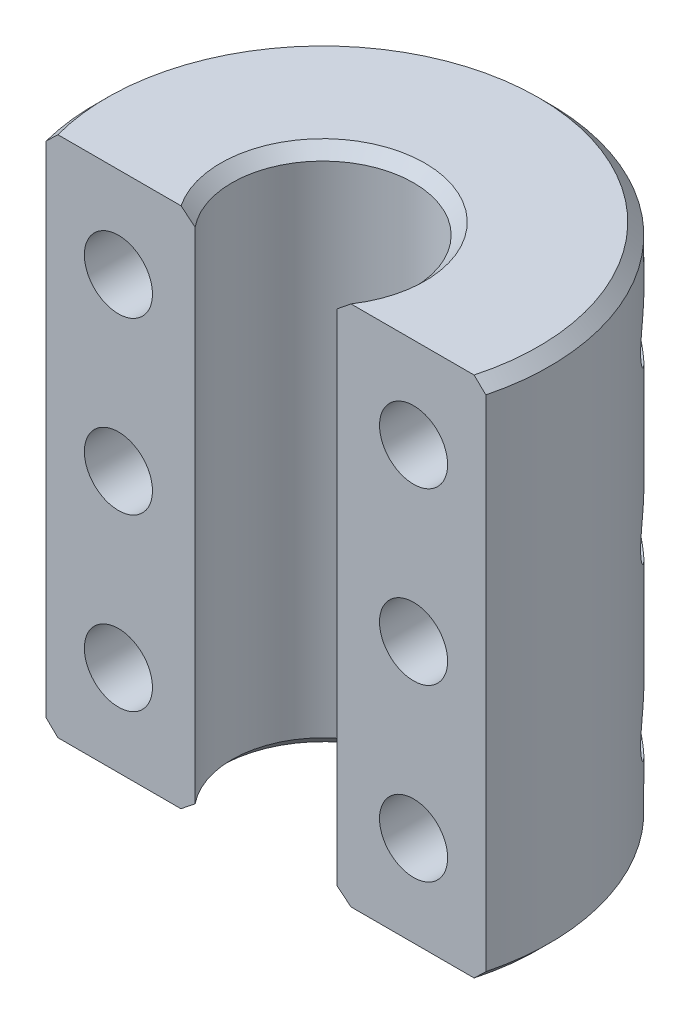
from build123d import *

# Parameters (mm, degrees)
SKETCH_1_R          = 10
SKETCH_1_R_2        = 4
EXTRUDE_1_DEPTH     = 23
CHAMFER_1_SIZE      = 0.5
SKETCH_2_W          = 20
SKETCH_2_H          = 23
CUT_EXTRUDE_1_DEPTH = 23
SKETCH_3_R          = 1.5
CUT_EXTRUDE_2_DEPTH = 29.022312538


with BuildPart() as part:
    # 草图1 → 凸台-拉伸1 (new body)
    with BuildSketch(Plane(origin=(0, 0, 0), x_dir=(1, 0, 0), z_dir=(0, 1, 0))):
        with Locations(Location((0, 0, 0), (0, 0, 270))):
            Circle(SKETCH_1_R)
        with Locations(Location((0, 0, 0), (0, 0, 270))):
            Circle(SKETCH_1_R_2, mode=Mode.SUBTRACT)
    extrude(amount=EXTRUDE_1_DEPTH)

    # 倒角1
    chamfer_1_edges = [part.edges().sort_by_distance(p)[0] for p in [
        (0, 0, -10),
        (0, 23, -10),
        (0, 0, -4),
        (0, 23, -4),
    ]]
    chamfer(chamfer_1_edges, length=CHAMFER_1_SIZE)

    # 草图2 → 切除-拉伸1 (cut)
    with BuildSketch(Plane.XY.offset(2.5)):
        with Locations((0, 11.5)):
            Rectangle(SKETCH_2_W, SKETCH_2_H)
    extrude(amount=CUT_EXTRUDE_1_DEPTH, mode=Mode.SUBTRACT)

    # 草图3 → 切除-拉伸2 (cut, through all)
    with BuildSketch(Plane.XY.offset(2.5)):
        with Locations((-6.5, 11.5)):
            Circle(SKETCH_3_R)
        with Locations((-6.5, 4)):
            Circle(SKETCH_3_R)
        with Locations((-6.5, 19)):
            Circle(SKETCH_3_R)
        with Locations((6.5, 19)):
            Circle(SKETCH_3_R)
        with Locations((6.5, 4)):
            Circle(SKETCH_3_R)
        with Locations((6.5, 11.5)):
            Circle(SKETCH_3_R)
    extrude(amount=-CUT_EXTRUDE_2_DEPTH, mode=Mode.SUBTRACT)


solid = part.part
